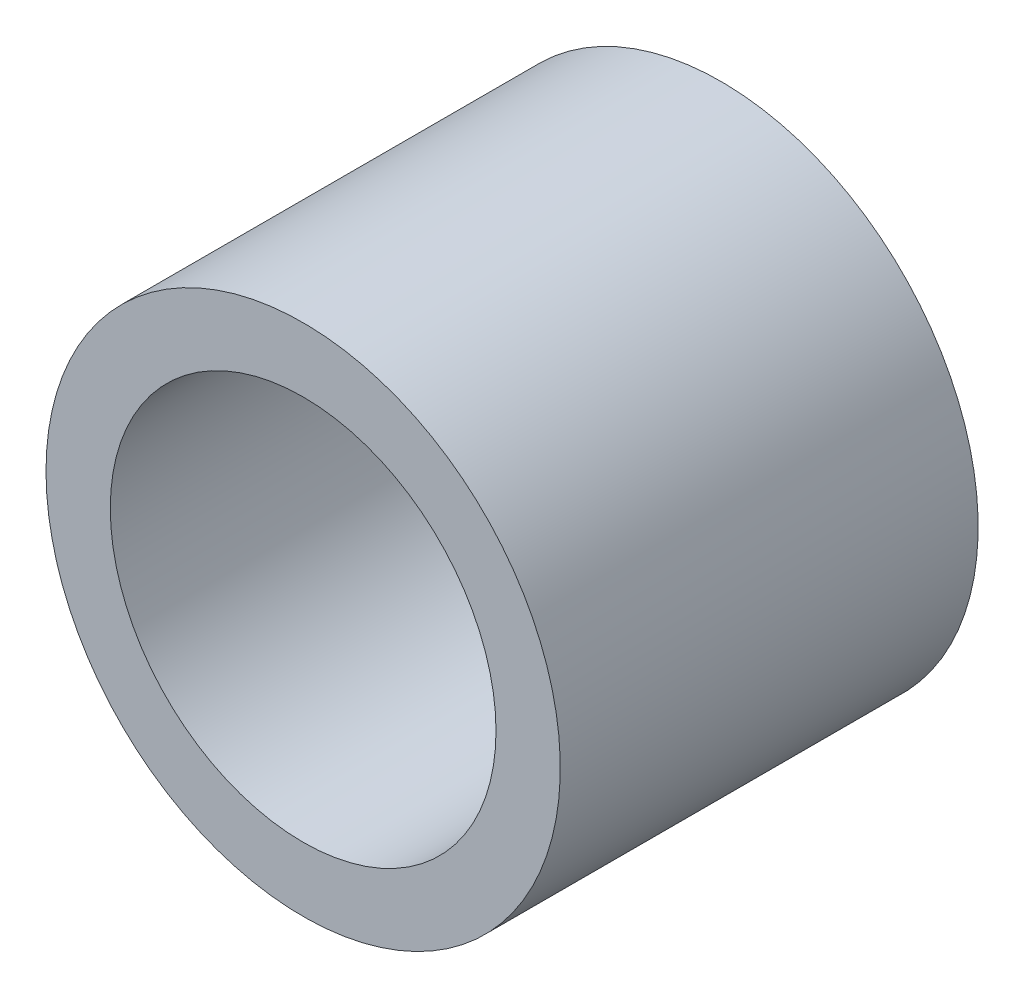
from build123d import *

# Parameters (mm, degrees)
SKETCH_1_R      = 16
SKETCH_1_R_2    = 12
EXTRUDE_1_DEPTH = 26


with BuildPart() as part:
    # Эскиз1 → Бобышка-Вытянуть1 (new body)
    with BuildSketch(Plane.XY):
        with Locations(Location((0, 0, 0), (0, 0, 180))):
            Circle(SKETCH_1_R)
        with Locations(Location((0, 0, 0), (0, 0, 180))):
            Circle(SKETCH_1_R_2, mode=Mode.SUBTRACT)
    extrude(amount=EXTRUDE_1_DEPTH)


solid = part.part
